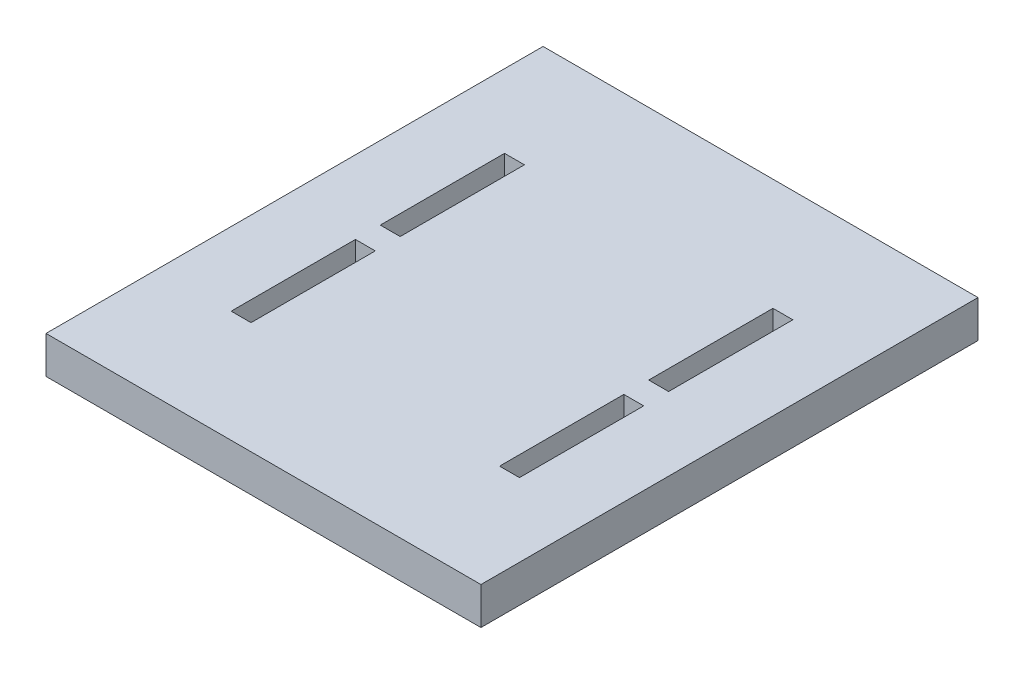
from build123d import *

# Parameters (mm, degrees)
SKETCH_1_W      = 70
SKETCH_1_H      = 80
SKETCH_1_W_2    = 3.2
SKETCH_1_H_2    = 20
EXTRUDE_1_DEPTH = 6


with BuildPart() as part:
    # 草图1 → 凸台-拉伸1 (new body)
    with BuildSketch(Plane(origin=(0, 0, 0), x_dir=(1, 0, 0), z_dir=(0, 1, 0))):
        with Locations((35, -40)):
            Rectangle(SKETCH_1_W, SKETCH_1_H)
        with Locations((13.4, -28)):
            Rectangle(SKETCH_1_W_2, SKETCH_1_H_2, mode=Mode.SUBTRACT)
        with Locations((13.4, -52)):
            Rectangle(SKETCH_1_W_2, SKETCH_1_H_2, mode=Mode.SUBTRACT)
        with Locations((56.6, -52)):
            Rectangle(SKETCH_1_W_2, SKETCH_1_H_2, mode=Mode.SUBTRACT)
        with Locations((56.6, -28)):
            Rectangle(SKETCH_1_W_2, SKETCH_1_H_2, mode=Mode.SUBTRACT)
    extrude(amount=EXTRUDE_1_DEPTH)


solid = part.part
